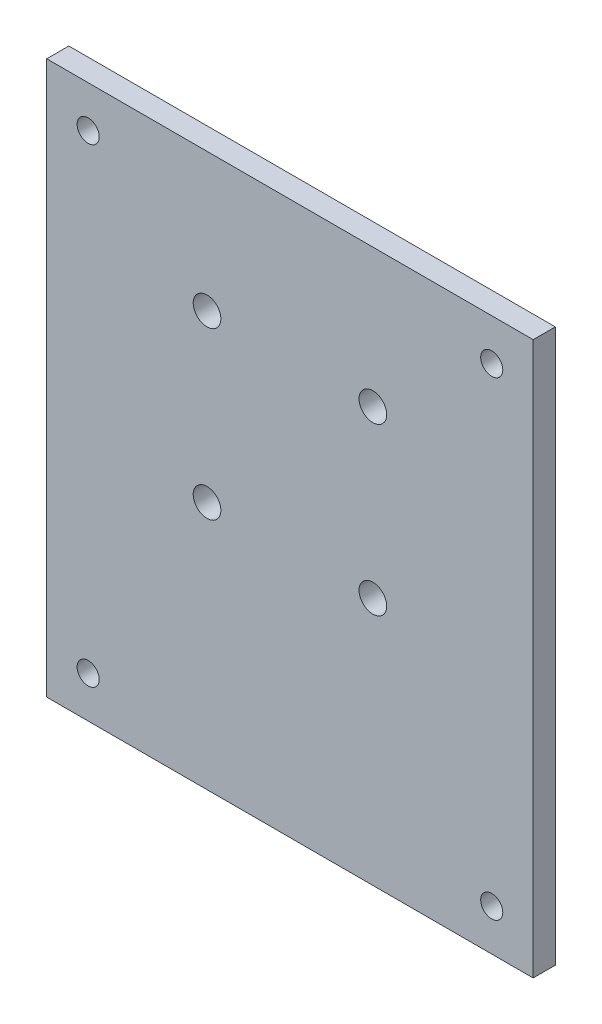
from build123d import *

# Parameters (mm, degrees)
SKETCH_1_W          = 88
SKETCH_1_H          = 100
EXTRUDE_1_DEPTH     = 4
SKETCH_2_R          = 2
CUT_EXTRUDE_1_DEPTH = 67.72330927
SKETCH_3_R          = 2.5
CUT_EXTRUDE_2_DEPTH = 67.72330927


with BuildPart() as part:
    # 草图1 → 凸台-拉伸1 (new body)
    with BuildSketch(Plane.XY):
        Rectangle(SKETCH_1_W, SKETCH_1_H)
    extrude(amount=EXTRUDE_1_DEPTH)

    # 草图2 → 切除-拉伸1 (cut, through all)
    with BuildSketch(Plane.XY.offset(4)):
        with Locations((-36.5, 42.5)):
            Circle(SKETCH_2_R)
        with Locations((36.5, 42.5)):
            Circle(SKETCH_2_R)
        with Locations((36.5, -42.5)):
            Circle(SKETCH_2_R)
        with Locations((-36.5, -42.5)):
            Circle(SKETCH_2_R)
    extrude(amount=-CUT_EXTRUDE_1_DEPTH, mode=Mode.SUBTRACT)

    # 草图3 → 切除-拉伸2 (cut, through all)
    with BuildSketch(Plane.XY.offset(4)):
        with Locations((-15, 25)):
            Circle(SKETCH_3_R)
        with Locations((15, 25)):
            Circle(SKETCH_3_R)
        with Locations((15, -5)):
            Circle(SKETCH_3_R)
        with Locations((-15, -5)):
            Circle(SKETCH_3_R)
    extrude(amount=-CUT_EXTRUDE_2_DEPTH, mode=Mode.SUBTRACT)


solid = part.part
